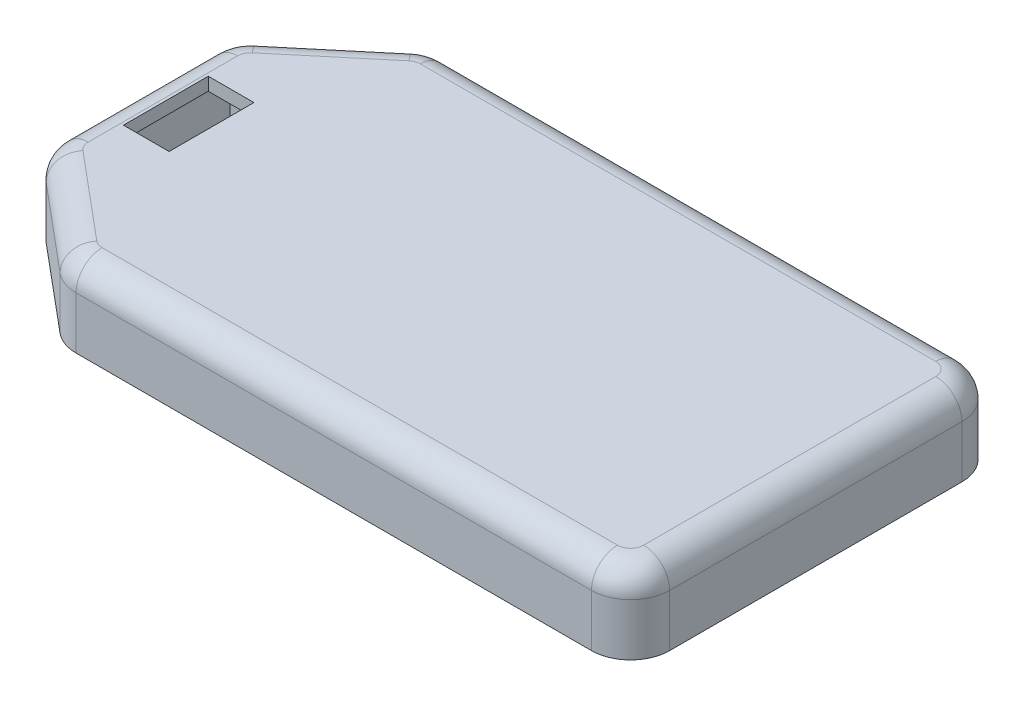
from build123d import *

# Parameters (mm, degrees)
BOSS_EXTRUDE1_DEPTH = 6
SKETCH2_W           = 40.6
SKETCH2_H           = 25.4
SKETCH2_W_2         = 5.95
SKETCH2_H_2         = 12.25
CUT_EXTRUDE1_DEPTH  = 5
SKETCH4_W           = 3.5
SKETCH4_H           = 6.5
CUT_EXTRUDE2_DEPTH  = 35.473394043
FILLET1_R           = 2


with BuildPart() as part:
    # Sketch1 → Boss-Extrude1 (new body)
    with BuildSketch(Plane(origin=(0, 0, 0), x_dir=(1, 0, 0), z_dir=(0, 1, 0))):
        with BuildLine():
            Line((26.775527572, -17.868301802), (26.775527572, 4.531698198))
            ThreePointArc((26.775527572, 4.531698198), (25.896847915, 6.653018542), (23.775527572, 7.531698198))
            Line((23.775527572, 7.531698198), (-15.734378779, 7.531698198))
            ThreePointArc((-15.734378779, 7.531698198), (-16.758931033, 7.351324535), (-17.660281792, 6.831893316))
            Line((-17.660281792, 6.831893316), (-24.200375442, 1.356016089))
            ThreePointArc((-24.200375442, 1.356016089), (-24.992717178, 0.325130027), (-25.274472428, -0.944179029))
            Line((-25.274472428, -0.944179029), (-25.274472428, -12.392424575))
            ThreePointArc((-25.274472428, -12.392424575), (-24.992717178, -13.661733631), (-24.200375442, -14.692619693))
            Line((-24.200375442, -14.692619693), (-17.660281792, -20.16849692))
            ThreePointArc((-17.660281792, -20.16849692), (-16.758931033, -20.687928139), (-15.734378779, -20.868301802))
            Line((-15.734378779, -20.868301802), (23.775527572, -20.868301802))
            ThreePointArc((23.775527572, -20.868301802), (25.896847915, -19.989622146), (26.775527572, -17.868301802))
        make_face()
    extrude(amount=BOSS_EXTRUDE1_DEPTH)

    # Sketch2 → Cut-Extrude1 (cut)
    with BuildSketch(Plane(origin=(0, 0, 0), x_dir=(1, 0, 0), z_dir=(0, 1, 0))):
        with Locations((4.975527572, -6.668301802)):
            Rectangle(SKETCH2_W, SKETCH2_H)
        with Locations((-21.299472428, -6.668301802)):
            Rectangle(SKETCH2_W_2, SKETCH2_H_2)
    extrude(amount=CUT_EXTRUDE1_DEPTH, mode=Mode.SUBTRACT)

    # Sketch4 → Cut-Extrude2 (cut, through all)
    with BuildSketch(Plane(origin=(0, 6, 0), x_dir=(1, 0, 0), z_dir=(0, 1, 0))):
        with Locations((-21.299472428, -6.668301802)):
            Rectangle(SKETCH4_W, SKETCH4_H)
    extrude(amount=-CUT_EXTRUDE2_DEPTH, mode=Mode.SUBTRACT)

    # Fillet1
    fillet1_edges = [part.edges().sort_by_distance(p)[0] for p in [
        (25.896847915, 6, -6.653018542),
        (4.020574397, 6, -7.531698198),
        (-16.758931033, 6, -7.351324535),
        (-20.930328617, 6, -4.093954703),
        (-24.992717178, 6, -0.325130027),
        (-25.274472428, 6, 6.668301802),
        (-24.992717178, 6, 13.661733631),
        (-20.930328617, 6, 17.430558307),
        (-16.758931033, 6, 20.687928139),
        (4.020574397, 6, 20.868301802),
        (25.896847915, 6, 19.989622146),
        (26.775527572, 6, 6.668301802),
    ]]
    fillet(fillet1_edges, radius=FILLET1_R)


solid = part.part
